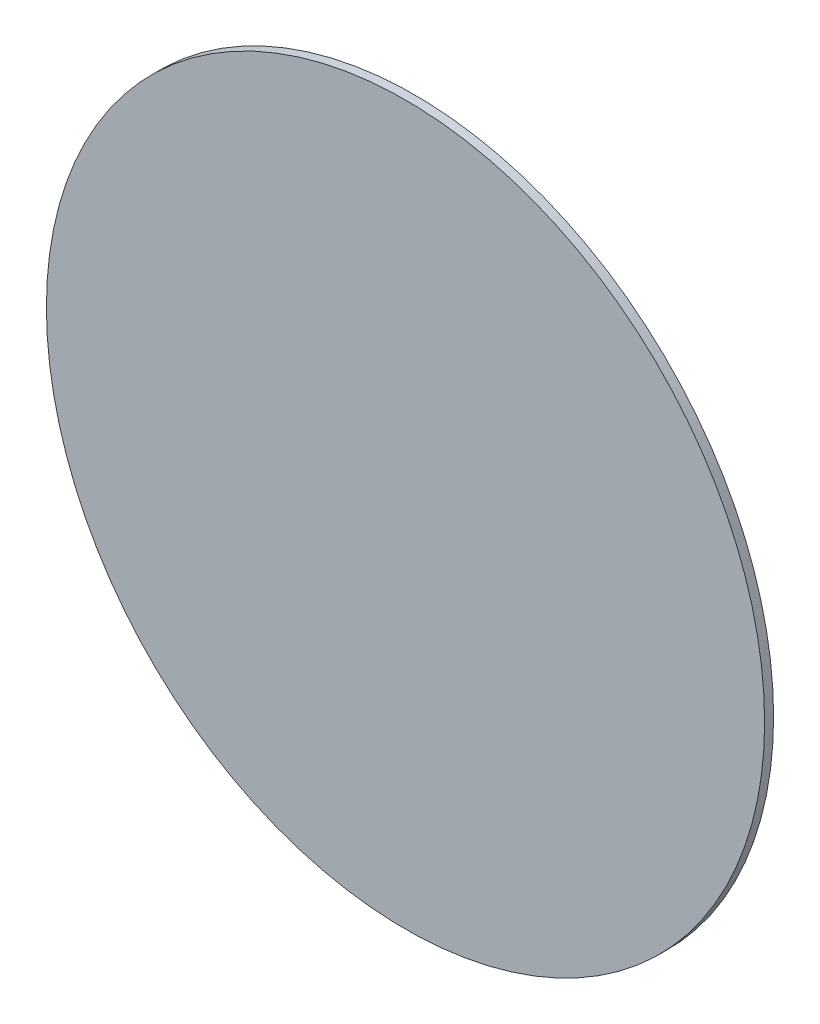
from build123d import *

# Parameters (mm, degrees)
SKETCH1_R           = 4
BOSS_EXTRUDE1_DEPTH = 0.1


with BuildPart() as part:
    # Sketch1 → Boss-Extrude1 (new body)
    with BuildSketch(Plane.XY):
        Circle(SKETCH1_R)
    extrude(amount=-BOSS_EXTRUDE1_DEPTH)


solid = part.part
